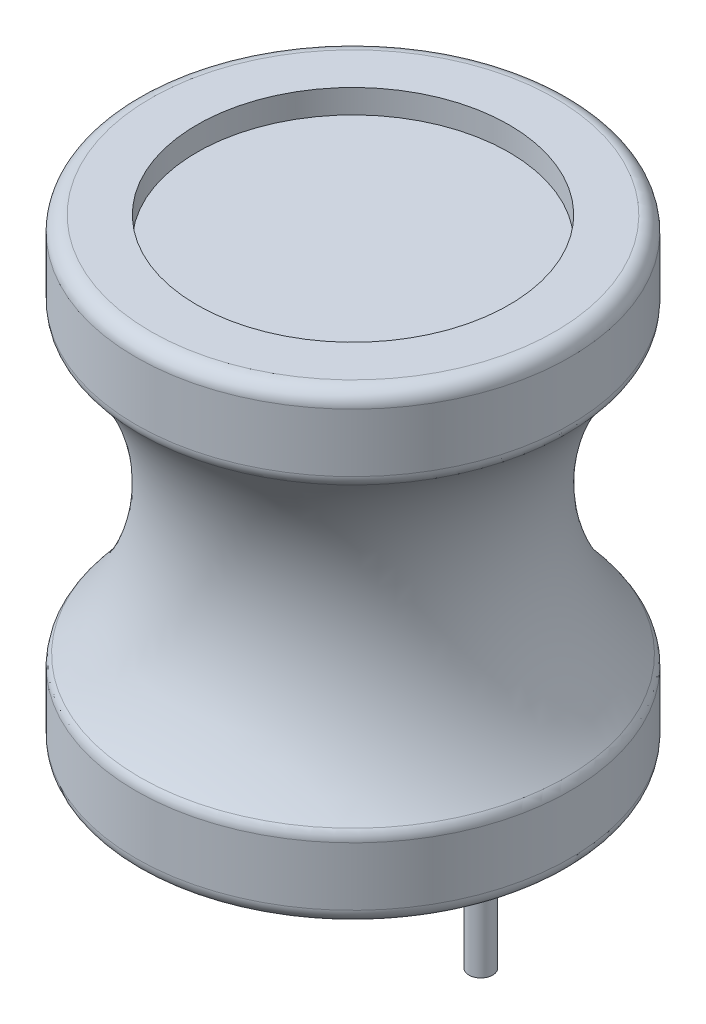
from build123d import *

# Parameters (mm, degrees)
SKETCH3_R           = 0.4
BOSS_EXTRUDE1_DEPTH = 5


with BuildPart() as part:
    # Sketch1 → Revolve1 (revolve)
    with BuildSketch(Plane(origin=(0, 0, 0), x_dir=(0, 0, -1), z_dir=(1, 0, 0))):
        with BuildLine():
            Line((-7.3, 7.3), (-7.3, 5.33482646))
            ThreePointArc((-7.3, 5.33482646), (-7.266727196, 5.155478404), (-7.1713371, 5))
            ThreePointArc((-7.1713371, 5), (-5.25, 0), (-7.1713371, -5))
            ThreePointArc((-7.1713371, -5), (-7.266727196, -5.155478404), (-7.3, -5.33482646))
            Line((-7.3, -5.33482646), (-7.3, -7.3))
            ThreePointArc((-7.3, -7.3), (-7.153553391, -7.653553391), (-6.8, -7.8))
            Line((-6.8, -7.8), (-5.25, -7.8))
            Line((-5.25, -7.8), (-5.25, -7))
            Line((-5.25, -7), (0, -7))
            Line((0, -7), (0, 7))
            Line((0, 7), (-5.25, 7))
            Line((-5.25, 7), (-5.25, 7.8))
            Line((-5.25, 7.8), (-6.8, 7.8))
            ThreePointArc((-6.8, 7.8), (-7.153553391, 7.653553391), (-7.3, 7.3))
        make_face()
    revolve(axis=Axis((0, 12.565257793, 0), (0, -1, 0)))

    # Sketch3 → Boss-Extrude1 (add)
    with BuildSketch(Plane.XZ.offset(7)):
        with Locations(Location((-4.3, 0, 0), (0, 0, 270))):
            Circle(SKETCH3_R)
        with Locations(Location((4.3, 0, 0), (0, 0, 90))):
            Circle(SKETCH3_R)
    extrude(amount=BOSS_EXTRUDE1_DEPTH)


solid = part.part
